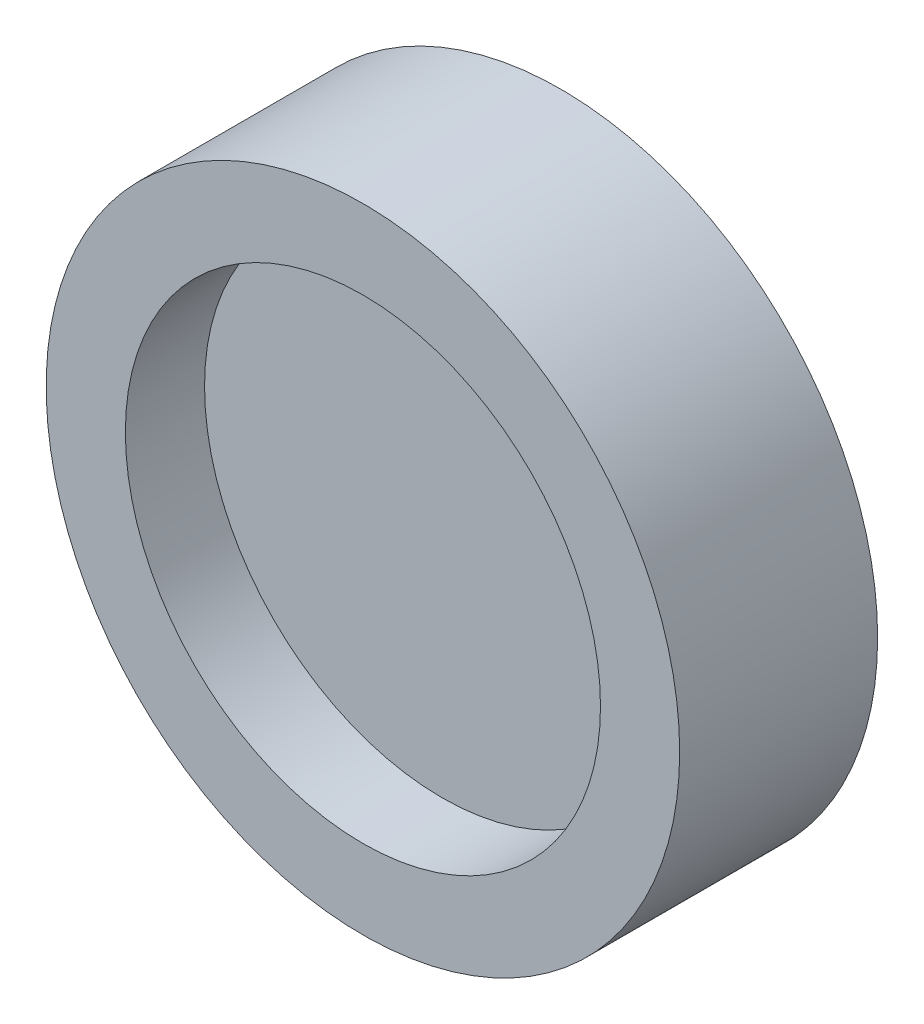
from build123d import *

# Parameters (mm, degrees)
SKETCH_1_R          = 8
EXTRUDE_1_DEPTH     = 5
SKETCH_2_R          = 6
CUT_EXTRUDE_1_DEPTH = 2


with BuildPart() as part:
    # Эскиз1 → Бобышка-Вытянуть1 (new body)
    with BuildSketch(Plane.XY):
        Circle(SKETCH_1_R)
    extrude(amount=EXTRUDE_1_DEPTH)

    # Эскиз2 → Вырез-Вытянуть1 (cut)
    with BuildSketch(Plane.XY.offset(5)):
        Circle(SKETCH_2_R)
    extrude(amount=-CUT_EXTRUDE_1_DEPTH, mode=Mode.SUBTRACT)


solid = part.part
